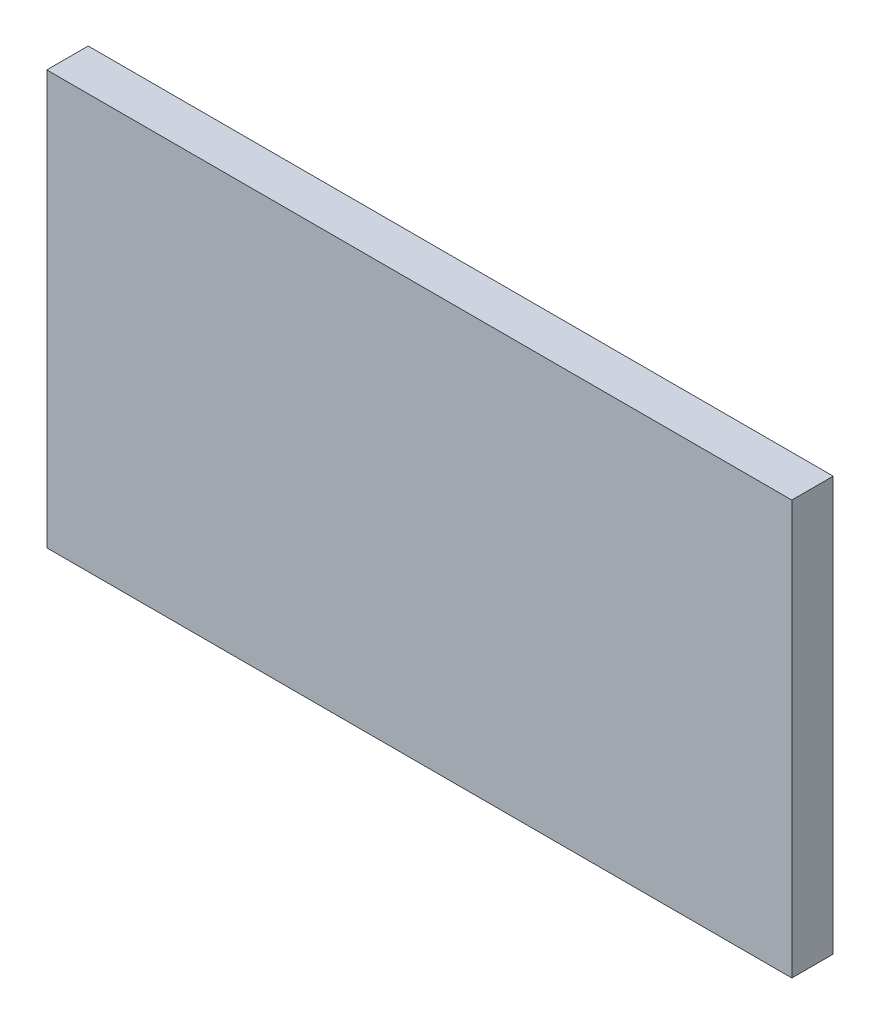
from build123d import *

# Parameters (mm, degrees)
SKETCH1_W           = 114.3
SKETCH1_H           = 63.5
BOSS_EXTRUDE1_DEPTH = 6.35


with BuildPart() as part:
    # Sketch1 → Boss-Extrude1 (new body)
    with BuildSketch(Plane.XY):
        Rectangle(SKETCH1_W, SKETCH1_H)
    extrude(amount=BOSS_EXTRUDE1_DEPTH)


solid = part.part
